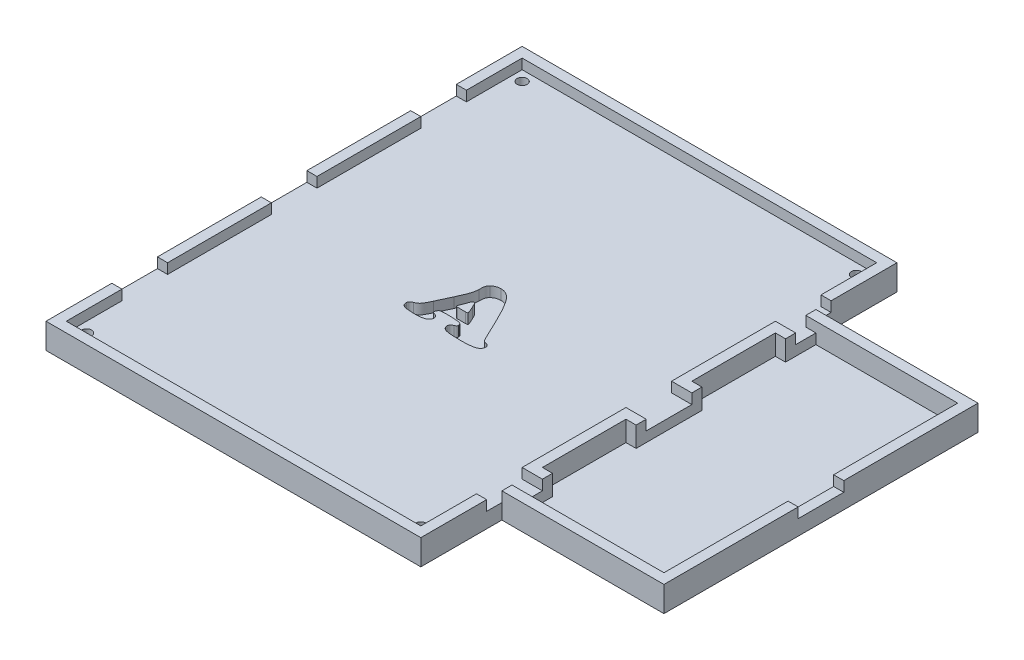
from build123d import *

# Parameters (mm, degrees)
SKETCH1_W               = 74
SKETCH1_H               = 94
BOSS_EXTRUDE2_DEPTH     = 5
SKETCH4_W               = 70
SKETCH4_H               = 90
CUT_EXTRUDE2_DEPTH      = 2
CUT_EXTRUDE3_DEPTH      = 60.891568689
CUT_EXTRUDE3_DEPTH_BACK = 60.891568689
SKETCH5_R               = 1
SKETCH6_W               = 2
SKETCH6_H               = 9
CUT_EXTRUDE5_DEPTH      = 2
BOSS_EXTRUDE3_REACH     = 62.025
SKETCH7_W               = 32
SKETCH7_H               = 62
CUT_EXTRUDE6_DEPTH      = 4
SKETCH11_W              = 2
SKETCH11_H              = 9
CUT_EXTRUDE7_DEPTH      = 2
SKETCH12_W              = 2
SKETCH12_H              = 4
CUT_EXTRUDE8_DEPTH      = 2
SKETCH13_W              = 2
SKETCH13_H              = 9
CUT_EXTRUDE10_DEPTH     = 2
CUT_EXTRUDE11_DEPTH     = 2


with BuildPart() as part:
    # Sketch1 → Boss-Extrude2 (new body)
    with BuildSketch(Plane(origin=(0, 0, 0), x_dir=(1, 0, 0), z_dir=(0, 1, 0))):
        Rectangle(SKETCH1_W, SKETCH1_H)
    extrude(amount=BOSS_EXTRUDE2_DEPTH)

    # Sketch4 → Cut-Extrude2 (cut)
    with BuildSketch(Plane(origin=(0, 5, 0), x_dir=(1, 0, 0), z_dir=(0, 1, 0))):
        Rectangle(SKETCH4_W, SKETCH4_H)
    extrude(amount=-CUT_EXTRUDE2_DEPTH, mode=Mode.SUBTRACT)

    # Sketch5 → Cut-Extrude3 (cut, two sides: drawn at the far end of the back side and taken through both)
    with BuildSketch(Plane(origin=(0, 3, 0), x_dir=(1, 0, 0), z_dir=(0, 1, 0)).offset(-CUT_EXTRUDE3_DEPTH_BACK)):
        with Locations(Location((33, 43, 0), (0, 0, 270))):
            Circle(SKETCH5_R)
        with Locations(Location((33, -43, 0), (0, 0, 270))):
            Circle(SKETCH5_R)
        with Locations(Location((-33, -43, 0), (0, 0, 270))):
            Circle(SKETCH5_R)
        with Locations(Location((-33, 43, 0), (0, 0, 270))):
            Circle(SKETCH5_R)
    extrude(amount=CUT_EXTRUDE3_DEPTH + CUT_EXTRUDE3_DEPTH_BACK, mode=Mode.SUBTRACT)

    # Sketch6 → Cut-Extrude5 (cut)
    with BuildSketch(Plane(origin=(0, 5, 0), x_dir=(1, 0, 0), z_dir=(0, 1, 0))):
        with Locations((36, 29.5)):
            Rectangle(SKETCH6_W, SKETCH6_H)
        with Locations((36, -29.5)):
            Rectangle(SKETCH6_W, SKETCH6_H)
        with Locations((36, 0)):
            Rectangle(SKETCH6_W, SKETCH6_H)
        with Locations((-36, -29.5)):
            Rectangle(SKETCH6_W, SKETCH6_H)
        with Locations((-36, 0)):
            Rectangle(SKETCH6_W, SKETCH6_H)
        with Locations((-36, 29.5)):
            Rectangle(SKETCH6_W, SKETCH6_H)
    extrude(amount=-CUT_EXTRUDE5_DEPTH, mode=Mode.SUBTRACT)

    # Boss-Extrude3: up to this face of the body (flat: up to its plane)
    boss_extrude3_end = Plane(part.part.faces().sort_by_distance((36, 5, 14.75))[0])
    # Sketch7 → Boss-Extrude3 (add, up to the picked face)
    with BuildSketch(Plane(origin=(0, 0, 0), x_dir=(1, 0, 0), z_dir=(0, 1, 0)), mode=Mode.PRIVATE) as boss_extrude3_sk1:
        with Locations((53, 0)):
            Rectangle(SKETCH7_W, SKETCH7_H)
    boss_extrude3_tool1 = split(extrude(boss_extrude3_sk1.sketch, amount=BOSS_EXTRUDE3_REACH, mode=Mode.PRIVATE), bisect_by=boss_extrude3_end, keep=Keep.BOTH, mode=Mode.PRIVATE)
    add(boss_extrude3_tool1.solids().sort_by(Axis((53, 0, 0), (0, 1, 0)))[0])

    # Sketch10 → Cut-Extrude6 (cut)
    with BuildSketch(Plane(origin=(0, 5, 0), x_dir=(1, 0, 0), z_dir=(0, 1, 0))):
        Polygon((39, -6.5), (37, -6.5), (37, -23), (39, -23), (39, -29), (67, -29), (67, 29), (39, 29), (39, 23), (37, 23), (37, 6.5), (39, 6.5), align=None)
    extrude(amount=-CUT_EXTRUDE6_DEPTH, mode=Mode.SUBTRACT)

    # Sketch11 → Cut-Extrude7 (cut)
    with BuildSketch(Plane(origin=(0, 5, 0), x_dir=(1, 0, 0), z_dir=(0, 1, 0))):
        with Locations((38, 0)):
            Rectangle(SKETCH11_W, SKETCH11_H)
    extrude(amount=-CUT_EXTRUDE7_DEPTH, mode=Mode.SUBTRACT)

    # Sketch12 → Cut-Extrude8 (cut)
    with BuildSketch(Plane(origin=(0, 5, 0), x_dir=(1, 0, 0), z_dir=(0, 1, 0))):
        with Locations((38, -27)):
            Rectangle(SKETCH12_W, SKETCH12_H)
        with Locations((38, 27)):
            Rectangle(SKETCH12_W, SKETCH12_H)
    extrude(amount=-CUT_EXTRUDE8_DEPTH, mode=Mode.SUBTRACT)

    # Sketch13 → Cut-Extrude10 (cut)
    with BuildSketch(Plane(origin=(0, 5, 0), x_dir=(1, 0, 0), z_dir=(0, 1, 0))):
        with Locations((68, 0)):
            Rectangle(SKETCH13_W, SKETCH13_H)
    extrude(amount=-CUT_EXTRUDE10_DEPTH, mode=Mode.SUBTRACT)

    # Sketch16 → Cut-Extrude11 (cut)
    with BuildSketch(Plane(origin=(0, 3, 0), x_dir=(1, 0, 0), z_dir=(0, 1, 0))):
        with BuildLine():
            Line((5.544822158, -0.846625372), (7.26932668, -4.463746493))
            add(Edge.make_bspline(
                [(7.26932668, -4.463746493), (7.308592122, -4.540825979), (7.380372883, -4.681734214), (7.48569179, -4.871415404), (7.581025862, -5.017647146), (7.672187955, -5.128721311), (7.774335535, -5.205767348), (7.891315115, -5.266806743), (8.030213139, -5.310972959), (8.130459021, -5.331492863), (8.183097158, -5.342267665)],
                knots=[0, 0, 0, 0, 1.551249296, 2.835823279, 3.887674552, 4.680507163, 5.396934973, 6.165372046, 7.036654718, 8, 8, 8, 8], degree=3))
            add(Edge.make_bspline(
                [(8.183097158, -5.342267665), (8.234900733, -5.352753172), (8.332959124, -5.372601068), (8.468729258, -5.420393147), (8.581415014, -5.488222004), (8.680556383, -5.564954164), (8.750275863, -5.666787827), (8.803995729, -5.779810318), (8.832805469, -5.909398049), (8.837064621, -6.000132264), (8.839276552, -6.04725379)],
                knots=[0, 0, 0, 0, 1.188147728, 2.249031157, 3.214526519, 4.138266139, 5.040746724, 5.959105291, 6.940090305, 8, 8, 8, 8], degree=3))
            add(Edge.make_bspline(
                [(8.839276552, -6.04725379), (8.836230318, -6.103414779), (8.830273127, -6.213242752), (8.796313797, -6.374317934), (8.728717076, -6.520269336), (8.641925686, -6.657227705), (8.524489108, -6.775326933), (8.387660818, -6.887568445), (8.220455857, -6.978958676), (8.03075668, -7.065195952), (7.812329788, -7.137022171), (7.564054691, -7.199327313), (7.283864701, -7.249300713), (6.971773168, -7.292257962), (6.628166023, -7.327470929), (6.252815176, -7.351368159), (5.845887378, -7.364170086), (5.563811237, -7.366524718), (5.417382358, -7.367747033)],
                knots=[0, 0, 0, 0, 0.669154604, 1.308593315, 1.944310898, 2.573900278, 3.228277189, 3.917118262, 4.673697051, 5.487465847, 6.395791151, 7.405543937, 8.532301338, 9.781375314, 11.154766521, 12.64250922, 14.257088986, 16, 16, 16, 16], degree=3))
            add(Edge.make_bspline(
                [(5.417382358, -7.367747033), (5.251982483, -7.367150428), (4.932007151, -7.365996261), (4.468211945, -7.359323759), (4.037195579, -7.34090023), (3.639187163, -7.324920785), (3.275150667, -7.295536649), (2.943877263, -7.26808008), (2.645445659, -7.230291473), (2.458154825, -7.198422086), (2.369673108, -7.183366047)],
                knots=[0, 0, 0, 0, 1.298627189, 2.512267108, 3.641368749, 4.685694753, 5.639232063, 6.5084825, 7.295363112, 8, 8, 8, 8], degree=3))
            add(Edge.make_bspline(
                [(2.369673108, -7.183366047), (2.296688941, -7.167553939), (2.155825575, -7.137035721), (1.962496978, -7.056064743), (1.790004977, -6.958356964), (1.643457931, -6.836757751), (1.525514657, -6.69509806), (1.440015279, -6.537691156), (1.385311215, -6.366249534), (1.379982677, -6.24650797), (1.377269562, -6.18553953)],
                knots=[0, 0, 0, 0, 1.166331712, 2.251082908, 3.265109133, 4.259312099, 5.213681381, 6.131398167, 7.048569829, 8, 8, 8, 8], degree=3))
            add(Edge.make_bspline(
                [(1.377269562, -6.18553953), (1.378173574, -6.13921335), (1.379876026, -6.051970986), (1.409900675, -5.930362436), (1.44741459, -5.822380435), (1.511951257, -5.730077229), (1.600296739, -5.650528581), (1.712882158, -5.573822317), (1.85665578, -5.504931967), (1.962676703, -5.462681725), (2.01989153, -5.439881129)],
                knots=[0, 0, 0, 0, 1.034123289, 1.947481109, 2.793293776, 3.579348416, 4.438618038, 5.443605229, 6.620426244, 8, 8, 8, 8], degree=3))
            add(Edge.make_bspline(
                [(2.01989153, -5.439881129), (2.081817055, -5.413596793), (2.194801955, -5.365640268), (2.332968873, -5.262267492), (2.417915761, -5.132210368), (2.429174537, -5.036941939), (2.43474875, -4.989774602)],
                knots=[0, 0, 0, 0, 1.235219993, 2.25369437, 3.135405222, 4, 4, 4, 4], degree=3))
            add(Edge.make_bspline(
                [(2.43474875, -4.989774602), (2.433073711, -4.946123091), (2.429836454, -4.861760196), (2.393441752, -4.743212485), (2.334248817, -4.638633362), (2.25203354, -4.548455591), (2.145677821, -4.474820739), (2.018342066, -4.414887941), (1.867585553, -4.369088847), (1.758065417, -4.351215929), (1.699936288, -4.341729664)],
                knots=[0, 0, 0, 0, 0.962079, 1.859357628, 2.709136698, 3.599944751, 4.53104535, 5.549527487, 6.699382267, 8, 8, 8, 8], degree=3))
            add(Edge.make_bspline(
                [(1.699936288, -4.341729664), (1.555431342, -4.325970809), (1.240789633, -4.291657844), (0.725847339, -4.265831411), (0.131056105, -4.245739395), (-0.292980415, -4.244679037), (-0.518058522, -4.2441162)],
                knots=[0, 0, 0, 0, 0.785110869, 1.709482137, 2.784195697, 4, 4, 4, 4], degree=3))
            add(Edge.make_bspline(
                [(-0.518058522, -4.2441162), (-0.612959056, -4.244894974), (-0.79373711, -4.246378476), (-1.049637685, -4.250405187), (-1.275565688, -4.26223964), (-1.47106468, -4.274143329), (-1.635682484, -4.29322476), (-1.770717663, -4.314267948), (-1.87612462, -4.33843911), (-1.933682787, -4.363670393), (-1.957857109, -4.374267485)],
                knots=[0, 0, 0, 0, 1.567934269, 2.986791457, 4.227588356, 5.305283775, 6.22211529, 6.963472166, 7.564660253, 8, 8, 8, 8], degree=3))
            add(Edge.make_bspline(
                [(-1.957857109, -4.374267485), (-2.005599582, -4.409827145), (-2.111337071, -4.488582787), (-2.218064789, -4.667128722), (-2.30385575, -4.864291245), (-2.315591962, -5.006110589), (-2.321196112, -5.07383064)],
                knots=[0, 0, 0, 0, 0.867762476, 1.921874156, 3.007675644, 4, 4, 4, 4], degree=3))
            add(Edge.make_bspline(
                [(-2.321196112, -5.07383064), (-2.319188149, -5.111270533), (-2.315635393, -5.177514185), (-2.256684319, -5.249889231), (-2.174900571, -5.279117969), (-2.07324211, -5.317601341), (-1.931706146, -5.375663584), (-1.821560396, -5.415099707), (-1.759918697, -5.437169643)],
                knots=[0, 0, 0, 0, 0.919306443, 1.626559585, 2.17364659, 3.069232284, 4.359832271, 6, 6, 6, 6], degree=3))
            add(Edge.make_bspline(
                [(-1.759918697, -5.437169643), (-1.717843975, -5.453223079), (-1.636761936, -5.484159593), (-1.527045682, -5.547215677), (-1.433740355, -5.621034791), (-1.354888254, -5.705552747), (-1.29917956, -5.806194617), (-1.253984904, -5.914734026), (-1.230240581, -6.036312407), (-1.227284666, -6.120377001), (-1.225756132, -6.16384765)],
                knots=[0, 0, 0, 0, 1.109490257, 2.138094521, 3.105962601, 4.037195274, 4.966290865, 5.926684947, 6.927867883, 8, 8, 8, 8], degree=3))
            add(Edge.make_bspline(
                [(-1.225756132, -6.16384765), (-1.227939289, -6.212805476), (-1.232186572, -6.308051861), (-1.262565145, -6.446592995), (-1.314457353, -6.57460321), (-1.386603596, -6.692987393), (-1.477431155, -6.803003093), (-1.589494915, -6.903902451), (-1.723046707, -6.991857736), (-1.875399507, -7.072346587), (-2.048698969, -7.140851667), (-2.241280455, -7.203687949), (-2.454348049, -7.255006419), (-2.687384484, -7.294299076), (-2.939772539, -7.326582476), (-3.211941384, -7.351517897), (-3.505092601, -7.364089632), (-3.707659058, -7.366499579), (-3.812512916, -7.367747033)],
                knots=[0, 0, 0, 0, 0.744158931, 1.447744989, 2.144452154, 2.835032806, 3.547687444, 4.306673216, 5.118561788, 5.973066851, 6.922433416, 7.948112059, 9.051416016, 10.25116308, 11.539864336, 12.919725915, 14.405567108, 16, 16, 16, 16], degree=3))
            add(Edge.make_bspline(
                [(-3.812512916, -7.367747033), (-3.930929048, -7.367564832), (-4.159681897, -7.367212861), (-4.490484068, -7.355012335), (-4.797190679, -7.340878237), (-5.078891686, -7.314059359), (-5.337403282, -7.290614251), (-5.570325184, -7.250827573), (-5.779763115, -7.209237024), (-5.909569019, -7.173244541), (-5.970855054, -7.156251196)],
                knots=[0, 0, 0, 0, 1.30634612, 2.52356154, 3.651964203, 4.69290921, 5.645465716, 6.514330931, 7.298562215, 8, 8, 8, 8], degree=3))
            add(Edge.make_bspline(
                [(-5.970855054, -7.156251196), (-6.021292892, -7.137927544), (-6.117882745, -7.102837243), (-6.247086754, -7.026617707), (-6.361087024, -6.94229742), (-6.448733321, -6.834286404), (-6.520565614, -6.715444267), (-6.569001425, -6.578920224), (-6.599097781, -6.429086196), (-6.603213239, -6.323978192), (-6.605342567, -6.269595569)],
                knots=[0, 0, 0, 0, 1.090263859, 2.087885422, 3.045131436, 3.959481521, 4.900128182, 5.860906481, 6.893238246, 8, 8, 8, 8], degree=3))
            add(Edge.make_bspline(
                [(-6.605342567, -6.269595569), (-6.604260694, -6.222416792), (-6.602201052, -6.132599051), (-6.573829569, -6.006561993), (-6.532229995, -5.895524238), (-6.466090785, -5.801517232), (-6.37584349, -5.720354826), (-6.262875742, -5.641929646), (-6.118451346, -5.573342451), (-6.013551709, -5.53059321), (-5.957297628, -5.507668256)],
                knots=[0, 0, 0, 0, 1.038291422, 1.976672511, 2.835455346, 3.637287795, 4.483485343, 5.50090057, 6.659818599, 8, 8, 8, 8], degree=3))
            add(Edge.make_bspline(
                [(-5.957297628, -5.507668256), (-5.863277746, -5.469018759), (-5.683455664, -5.395097872), (-5.437857261, -5.255960812), (-5.230611573, -5.095178171), (-5.08104567, -4.942038106), (-4.971318089, -4.798577362), (-4.883647914, -4.66385037), (-4.788862081, -4.501720921), (-4.683560711, -4.315749828), (-4.568734737, -4.102873561), (-4.447870052, -3.863140344), (-4.32069004, -3.595487701), (-4.232743189, -3.409001683), (-4.186697859, -3.311365327)],
                knots=[0, 0, 0, 0, 1.254563077, 2.399472722, 3.47335629, 4.483702101, 5.032888104, 5.701553417, 6.467234692, 7.351883775, 8.340668076, 9.453799114, 10.666914658, 12, 12, 12, 12], degree=3))
            Line((-4.186697859, -3.311365327), (-2.901453923, -0.553784982))
            add(Edge.make_bspline(
                [(-2.901453923, -0.553784982), (-2.844277928, -0.430972555), (-2.734347224, -0.194844497), (-2.57899533, 0.14868057), (-2.43794299, 0.46862649), (-2.310770214, 0.764849019), (-2.199779915, 1.03736276), (-2.100368978, 1.284019696), (-2.019976531, 1.50895006), (-1.929751795, 1.774223011), (-1.836207684, 2.087819775), (-1.762341908, 2.461127186), (-1.710325963, 2.829635117), (-1.701780155, 3.074915836), (-1.697554539, 3.196198909)],
                knots=[0, 0, 0, 0, 1.228608371, 2.362211354, 3.419224203, 4.399763267, 5.285695025, 6.087880885, 6.81131854, 7.451585028, 8.629346067, 9.775563366, 10.900090834, 12, 12, 12, 12], degree=3))
            add(Edge.make_bspline(
                [(-1.697554539, 3.196198909), (-1.695786492, 3.314617758), (-1.692544678, 3.531745415), (-1.675131293, 3.827884376), (-1.645608368, 4.064999104), (-1.609889574, 4.255735258), (-1.547754064, 4.416262763), (-1.463151782, 4.564559736), (-1.35240367, 4.711782537), (-1.262276687, 4.800740973), (-1.214910192, 4.847493334)],
                knots=[0, 0, 0, 0, 1.594623916, 2.923833144, 3.991009749, 4.812068535, 5.528521039, 6.296840392, 7.104899585, 8, 8, 8, 8], degree=3))
            add(Edge.make_bspline(
                [(-1.214910192, 4.847493334), (-1.161683833, 4.897489046), (-1.05609999, 4.996664333), (-0.880816094, 5.123751162), (-0.69650289, 5.233918918), (-0.498697253, 5.319470324), (-0.292786547, 5.391684741), (-0.07438983, 5.440142269), (0.154643378, 5.466475486), (0.310686895, 5.471356468), (0.390288986, 5.473846391)],
                knots=[0, 0, 0, 0, 0.989210821, 1.962273613, 2.929065756, 3.894614437, 4.878955268, 5.883830572, 6.920483757, 8, 8, 8, 8], degree=3))
            add(Edge.make_bspline(
                [(0.390288986, 5.473846391), (0.467214462, 5.471742322), (0.61995251, 5.467564625), (0.84830417, 5.434339416), (1.072410636, 5.375571938), (1.296376367, 5.301822972), (1.513595236, 5.19768262), (1.732135736, 5.079793991), (1.946334006, 4.935089936), (2.083034863, 4.825005128), (2.1527543, 4.768860266)],
                knots=[0, 0, 0, 0, 0.952345845, 1.890913809, 2.849094479, 3.81883948, 4.80529607, 5.827115769, 6.891797267, 8, 8, 8, 8], degree=3))
            add(Edge.make_bspline(
                [(2.1527543, 4.768860266), (2.20294416, 4.724185091), (2.309953486, 4.628933574), (2.46977066, 4.466223252), (2.634888883, 4.272110401), (2.807022297, 4.048690029), (2.992792387, 3.800455934), (3.181304069, 3.5188269), (3.381601599, 3.210933024), (3.590417421, 2.875157287), (3.805088096, 2.509124688), (4.029125743, 2.114942134), (4.261942619, 1.691709039), (4.504798215, 1.24055533), (4.751615374, 0.759216635), (5.011575028, 0.250632018), (5.275669558, -0.287995479), (5.453757307, -0.657619032), (5.544822158, -0.846625372)],
                knots=[0, 0, 0, 0, 0.489223549, 1.043068895, 1.659157019, 2.343785313, 3.096755631, 3.91641444, 4.810951161, 5.771638313, 6.795454461, 7.900815786, 9.073253921, 10.312948371, 11.631730857, 13.012235712, 14.472212097, 16, 16, 16, 16], degree=3))
        make_face()
        with BuildLine():
            Line((-0.737688815, -1.988160599), (0.802434721, -1.988160599))
            add(Edge.make_bspline(
                [(0.802434721, -1.988160599), (0.864391735, -1.987487331), (0.971206676, -1.986326606), (1.100100307, -1.972131615), (1.192893057, -1.959426626), (1.217177337, -1.924203769), (1.225426396, -1.912239016)],
                knots=[0, 0, 0, 0, 1.666684775, 2.873392773, 3.617305953, 4, 4, 4, 4], degree=3))
            add(Edge.make_bspline(
                [(1.225426396, -1.912239016), (1.223668243, -1.88225931), (1.219503663, -1.811245651), (1.184714023, -1.693455571), (1.139362189, -1.54570105), (1.073558886, -1.370284409), (0.988400599, -1.167732745), (0.889169129, -0.935867154), (0.764826129, -0.679236758), (0.6776484, -0.497771091), (0.63161116, -0.401941816)],
                knots=[0, 0, 0, 0, 0.441079327, 1.044795316, 1.798375639, 2.720695128, 3.800950404, 5.034944857, 6.434199227, 8, 8, 8, 8], degree=3))
            add(Edge.make_bspline(
                [(0.63161116, -0.401941816), (0.593126174, -0.319519053), (0.522492325, -0.168243516), (0.421120122, 0.035280488), (0.331003502, 0.192804771), (0.257186939, 0.312719719), (0.187640179, 0.398642489), (0.11829421, 0.457950896), (0.046151357, 0.497665049), (-0.005148619, 0.501727109), (-0.029991204, 0.503694206)],
                knots=[0, 0, 0, 0, 1.874915164, 3.441146432, 4.684238361, 5.614356338, 6.341820865, 6.950033589, 7.491542058, 8, 8, 8, 8], degree=3))
            add(Edge.make_bspline(
                [(-0.029991204, 0.503694206), (-0.074536227, 0.495020453), (-0.17367911, 0.47571547), (-0.292637596, 0.339386992), (-0.391184885, 0.141671182), (-0.442768864, -0.018468788), (-0.471963275, -0.109101426)],
                knots=[0, 0, 0, 0, 0.665674645, 1.481577505, 2.574676424, 4, 4, 4, 4], degree=3))
            add(Edge.make_bspline(
                [(-0.471963275, -0.109101426), (-0.480159781, -0.132579905), (-0.503429324, -0.199234345), (-0.545822293, -0.330027475), (-0.612086076, -0.517917335), (-0.659447484, -0.663920094), (-0.686170598, -0.746300424)],
                knots=[0, 0, 0, 0, 0.443897845, 1.260207774, 2.454104652, 4, 4, 4, 4], degree=3))
            add(Edge.make_bspline(
                [(-0.686170598, -0.746300424), (-0.719273774, -0.818362732), (-0.781461807, -0.953739866), (-0.861038535, -1.149077273), (-0.936340309, -1.317043936), (-0.992478982, -1.466289), (-1.04035777, -1.59001023), (-1.067767811, -1.693572514), (-1.094573854, -1.77083861), (-1.097223983, -1.817205562), (-1.098316333, -1.836317433)],
                knots=[0, 0, 0, 0, 1.628170328, 3.058700699, 4.330808198, 5.406141206, 6.333747151, 7.050155173, 7.608485986, 8, 8, 8, 8], degree=3))
            add(Edge.make_bspline(
                [(-1.098316333, -1.836317433), (-1.093614712, -1.859622106), (-1.083187891, -1.911305063), (-0.998707596, -1.960651598), (-0.882214847, -1.981991603), (-0.79038522, -1.985911289), (-0.737688815, -1.988160599)],
                knots=[0, 0, 0, 0, 0.642837769, 1.425626392, 2.522696426, 4, 4, 4, 4], degree=3))
        make_face(mode=Mode.SUBTRACT)
    extrude(amount=-CUT_EXTRUDE11_DEPTH, mode=Mode.SUBTRACT)


solid = part.part
